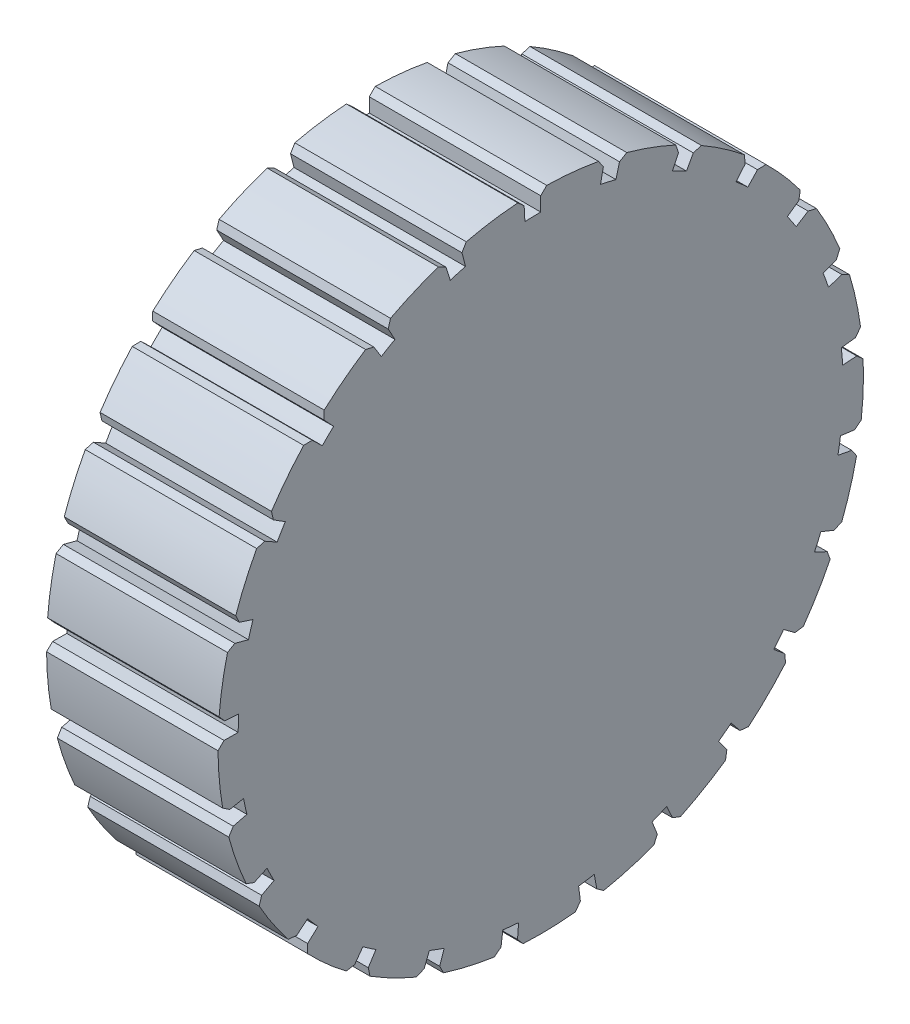
from build123d import *

# Parameters (mm, degrees)
SKETCH1_R                    = 3.2
BOSS_EXTRUDE1_DEPTH          = 0.85
CUT_EXTRUDE1_REACH           = 6.834
CHAMFER1_SIZE                = 0.06
CHAMFER2_SIZE                = 0.06
CIRPATTERN1_COUNT            = 25
CHAMFER1_OF_CIRPATTERN1_SIZE = 0.06
CHAMFER2_OF_CIRPATTERN1_SIZE = 0.06


with BuildPart() as part:
    # Sketch1 → Boss-Extrude1 (new, symmetric)
    with BuildSketch(Plane(origin=(0, 0, 0), x_dir=(0, 0, -1), z_dir=(1, 0, 0))):
        Circle(SKETCH1_R)
    extrude(amount=BOSS_EXTRUDE1_DEPTH, both=True)

    # Sketch2 → Cut-Extrude1 (cut, up to next)
    with BuildSketch(Plane(origin=(0.85, 0, 0), x_dir=(0, 0, -1), z_dir=(1, 0, 0)), mode=Mode.PRIVATE) as cut_extrude1_sk1:
        with BuildLine():
            Line((0, 3.2), (0, 3))
            ThreePointArc((0, 3), (-0.078530845, 2.998971975), (-0.157007869, 2.995888604))
            Line((-0.157007869, 2.995888604), (-0.16747506, 3.195614511))
            ThreePointArc((-0.16747506, 3.195614511), (-0.083766235, 3.19890344), (0, 3.2))
        make_face()
    cut_extrude1_tool1 = extrude(cut_extrude1_sk1.sketch, amount=-CUT_EXTRUDE1_REACH, mode=Mode.PRIVATE) & part.part
    cut_extrude1 = cut_extrude1_tool1.solids().sort_by_distance((0.85, 3.099659, 0.081167))[0]
    add(cut_extrude1, mode=Mode.SUBTRACT)

    # Chamfer1
    chamfer1_edges = [part.edges().sort_by_distance(p)[0] for p in [
        (0, 3.195614511, 0.16747506),
    ]]
    chamfer(chamfer1_edges, length=CHAMFER1_SIZE)

    # Chamfer2
    chamfer2_edges = [part.edges().sort_by_distance(p)[0] for p in [
        (0, 3.2, 0),
    ]]
    chamfer(chamfer2_edges, length=CHAMFER2_SIZE)

    # CirPattern1: Cut-Extrude1 ×25 about axis
    cirpattern1_axis = Axis((0, 0, 0), (1, 0, 0))
    for i in range(1, CIRPATTERN1_COUNT):
        add(cut_extrude1.rotate(cirpattern1_axis, i * 360 / CIRPATTERN1_COUNT), mode=Mode.SUBTRACT)

    # Chamfer1 of CirPattern1
    chamfer1_of_cirpattern1_edges = [part.edges().sort_by_distance(p)[0] for p in [
        (0, 3.053569051, 0.956930535),
        (0, 2.719656618, 1.686258546),
        (0, 2.214858156, 2.30963273),
        (0, 1.570892012, 2.787884196),
        (0, 0.828220944, 3.090962644),
        (0, 0.033509709, 3.199824542),
        (0, -0.763307064, 3.107629696),
        (0, -1.512162448, 2.820171047),
        (0, -2.166003103, 2.355510679),
        (0, -2.683745817, 1.742844912),
        (0, -3.032858912, 1.02066979),
        (0, -3.191406327, 0.234362231),
        (0, -3.149425946, -0.566671169),
        (0, -2.909555549, -1.332098535),
        (0, -2.486867077, -2.013825251),
        (0, -1.9079196, -2.569015921),
        (0, -1.209090518, -2.962785871),
        (0, -0.434289832, -3.17039309),
        (0, 0.367798882, -3.17879285),
        (0, 1.146777439, -2.987457365),
        (0, 1.853699751, -2.608408946),
        (0, 2.444147292, -2.065464601),
        (0, 2.881020068, -1.392739518),
        (0, 3.136867759, -0.632503489),
    ]]
    chamfer(chamfer1_of_cirpattern1_edges, length=CHAMFER1_OF_CIRPATTERN1_SIZE)

    # Chamfer2 of CirPattern1
    chamfer2_of_cirpattern1_edges = [part.edges().sort_by_distance(p)[0] for p in [
        (0, 3.099466116, 0.795807639),
        (0, 2.804181376, 1.541611757),
        (0, 2.332699608, 2.190550739),
        (0, 1.714645744, 2.701849362),
        (0, 0.988854382, 3.043380852),
        (0, 0.200929662, 3.193685531),
        (0, -0.599620207, 3.143319202),
        (0, -1.362493733, 2.895446568),
        (0, -2.039756767, 2.465642377),
        (0, -2.588854382, 1.880912807),
        (0, -2.975284755, 1.177998569),
        (0, -3.174767044, 0.401066347),
        (0, -3.174767044, -0.401066347),
        (0, -2.975284755, -1.177998569),
        (0, -2.588854382, -1.880912807),
        (0, -2.039756767, -2.465642377),
        (0, -1.362493733, -2.895446568),
        (0, -0.599620207, -3.143319202),
        (0, 0.200929662, -3.193685531),
        (0, 0.988854382, -3.043380852),
        (0, 1.714645744, -2.701849362),
        (0, 2.332699608, -2.190550739),
        (0, 2.804181376, -1.541611757),
        (0, 3.099466116, -0.795807639),
    ]]
    chamfer(chamfer2_of_cirpattern1_edges, length=CHAMFER2_OF_CIRPATTERN1_SIZE)


solid = part.part
